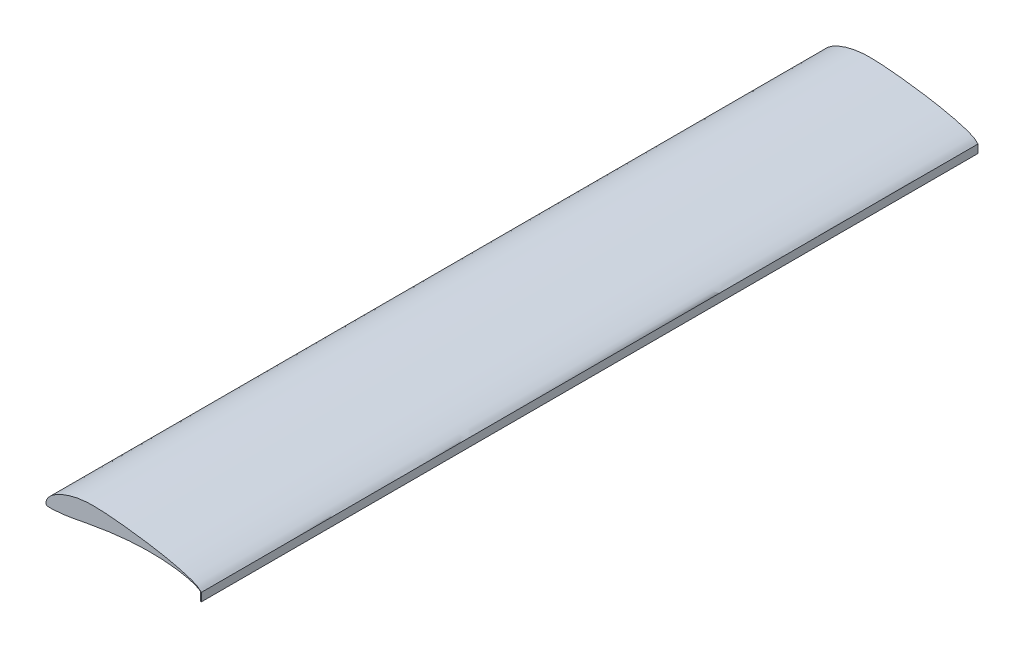
from build123d import *

# Parameters (mm, degrees)
BOSS_EXTRUDE1_DEPTH = 952.5
BOSS_EXTRUDE2_DEPTH = 952.5


with BuildPart() as part:
    # Sketch1 → Boss-Extrude1 (new body)
    with BuildSketch(Plane.XY):
        with BuildLine():
            add(Edge.make_bspline(
                [(190.5, 0), (190.50114045, 0.004849596), (189.874896953, 0.471443658), (189.345268774, 0.991100653), (188.169280274, 2.076506623), (186.781888796, 3.231171027), (184.884056421, 4.395201218), (182.524087437, 5.523278068), (179.675049468, 6.700562898), (176.341285283, 7.910663106), (172.538347889, 9.145030234), (168.285979658, 10.392947032), (163.607992669, 11.648556379), (158.530216744, 12.900329382), (153.081764098, 14.139204517), (147.295108851, 15.357443778), (141.205587005, 16.548784485), (134.84878908, 17.698566485), (128.264745028, 18.805147072), (121.49139922, 19.854276891), (114.572555058, 20.848004574), (107.552554075, 21.778455325), (100.48224217, 22.642651753), (93.418141124, 23.446712837), (86.418731173, 24.170350038), (79.541035437, 24.800019665), (72.833426008, 25.300280471), (66.334219213, 25.644395699), (60.079572264, 25.793000688), (54.101526828, 25.777182658), (48.411234272, 25.484480075), (43.006490333, 24.891331475), (37.865293507, 24.05261056), (32.986402962, 22.966055018), (28.374831045, 21.691917078), (24.050089889, 20.252763674), (20.030572218, 18.682249461), (16.341255786, 16.988788676), (12.993972054, 15.206763446), (10.006931348, 13.356438838), (7.398865706, 11.462888358), (5.170851216, 9.566248098), (3.355198002, 7.645814805), (1.960544743, 5.718219472), (0.930349506, 3.842925922), (0.270103383, 2.062423545), (-0.044503927, 0.419020389), (0.016223798, -0.970909151), (0.374066578, -2.245698506), (1.704225489, -2.87851328), (3.49264161, -2.9672952), (5.939188196, -3.053342986), (9.015893195, -2.920669006), (12.687983762, -2.676854663), (16.914593363, -2.286316955), (21.652472068, -1.757902645), (26.878516736, -1.080272914), (32.590173476, -0.133184537), (38.815251855, 1.054448935), (45.584873075, 2.346973137), (52.865947778, 3.71169339), (60.612743159, 5.091964511), (68.768366475, 6.435986546), (77.269545833, 7.69887908), (86.043018462, 8.834314674), (95.009886978, 9.809232182), (104.085447691, 10.579864329), (113.17862511, 11.126147499), (122.194418874, 11.426469616), (131.035023441, 11.464402451), (139.601808023, 11.237368645), (147.796677859, 10.750683104), (155.521090801, 10.010625382), (162.683083088, 9.045602512), (169.189407873, 7.883615818), (174.96378138, 6.563581677), (179.899784557, 5.151086339), (183.939394111, 3.643549372), (186.821551542, 2.263960045), (188.946489274, 0.988345413), (189.762798975, 0.494703594), (190.498836365, -0.004948188), (190.5, 0)],
                knots=[0, 0, 0, 0, 0.000979678, 0.003648862, 0.007483499, 0.012095277, 0.017525591, 0.02405178, 0.031783051, 0.040677828, 0.050710301, 0.061833229, 0.07398925, 0.087118173, 0.101145049, 0.115990637, 0.131570422, 0.147788379, 0.164550917, 0.181757895, 0.199311955, 0.217095072, 0.234990228, 0.252856883, 0.270540594, 0.287886779, 0.304773438, 0.321101419, 0.336806063, 0.351800033, 0.366031063, 0.379615675, 0.392652963, 0.405170359, 0.417171919, 0.428603517, 0.439418959, 0.449596586, 0.459102079, 0.467907878, 0.475988301, 0.483308969, 0.489874508, 0.49580325, 0.501149412, 0.505903073, 0.510046769, 0.513579311, 0.516446927, 0.519350053, 0.523823355, 0.529973794, 0.537715654, 0.546967844, 0.557637367, 0.569620481, 0.582804124, 0.597246961, 0.613135037, 0.6304436, 0.649056124, 0.668822257, 0.689594964, 0.711189651, 0.733426689, 0.756094118, 0.778988554, 0.801889683, 0.824566598, 0.846792285, 0.868338291, 0.888978163, 0.908492011, 0.926658768, 0.943286193, 0.95816921, 0.971135822, 0.981955623, 0.990251791, 0.995852565, 0.999000406, 1, 1, 1, 1], degree=3))
        make_face()
    extrude(amount=BOSS_EXTRUDE1_DEPTH)

    # Sketch4 → Boss-Extrude2 (add, through all)
    with BuildSketch(Plane.XY.offset(952.5)):
        Polygon((190.5, 0), (190.5, -10.16), (189.23, -10.16), (189.23, 0.94872941), align=None)
    extrude(amount=-BOSS_EXTRUDE2_DEPTH)


solid = part.part
